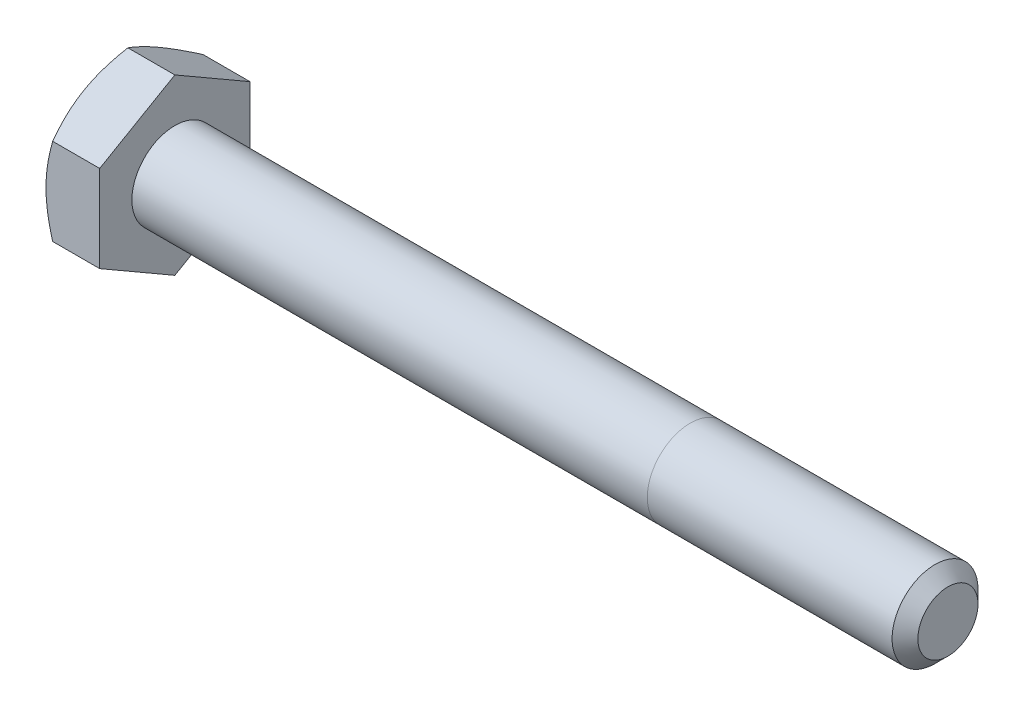
from build123d import *

# Parameters (mm, degrees)
SKETCH5_R           = 3.175
BOSS_EXTRUDE3_DEPTH = 57.15
CHAMFER1_SIZE       = 0.9525
BOSS_EXTRUDE4_DEPTH = 3.96875
SKETCH8_OUTSIDE_W   = 243.016
SKETCH8_OUTSIDE_H   = 244.736
SKETCH8_OUTSIDE_R   = 5.55625
CUT_EXTRUDE3_DEPTH  = 62.705235335
CUT_EXTRUDE3_DRAFT  = -60
CUT_EXTRUDE4_DEPTH  = 0.254
CIRPATTERN1_COUNT   = 3


with BuildPart() as part:
    # Sketch5 → Boss-Extrude3 (new body)
    with BuildSketch(Plane(origin=(30.559375, 0, 0), x_dir=(0, 0, -1), z_dir=(1, 0, 0))):
        Circle(SKETCH5_R)
    extrude(amount=-BOSS_EXTRUDE3_DEPTH)

    # Chamfer1
    chamfer1_edges = [part.edges().sort_by_distance(p)[0] for p in [
        (30.559375, 0, 3.175),
    ]]
    chamfer(chamfer1_edges, length=CHAMFER1_SIZE)

    # Sketch11 → Revolve1 (revolve)
    with BuildSketch(Plane.XY):
        Polygon((-26.590625, 3.175), (-26.590625, 0), (14.684375, 0), (11.509375, 3.175), align=None)
    revolve(axis=Axis((-26.590625, 0, 0), (1, 0, 0)))

    # Sketch6 → Boss-Extrude4 (add)
    with BuildSketch(Plane.ZY.offset(26.590625)):
        Polygon((5.55625, 3.207902433), (0, 6.415804866), (-5.55625, 3.207902433), (-5.55625, -3.207902433), (0, -6.415804866), (5.55625, -3.207902433), align=None)
    extrude(amount=BOSS_EXTRUDE4_DEPTH)


with BuildPart() as cut_extrude3_tool:
    # Sketch8 outside → Cut-Extrude3 (with draft: the straight prism first)
    with BuildSketch(Plane.ZY.offset(30.559375)):
        Rectangle(SKETCH8_OUTSIDE_W, SKETCH8_OUTSIDE_H)
        Circle(SKETCH8_OUTSIDE_R, mode=Mode.SUBTRACT)
    extrude(amount=-CUT_EXTRUDE3_DEPTH)
    # Cut-Extrude3: the draft: its side faces are tilted about the plane it starts from
    cut_extrude3_sides = [cut_extrude3_tool.faces().sort_by_distance(p)[0] for p in [
        (0.793242667, -122.368, 0),
        (0.793242667, 0, 121.508),
        (0.793242667, 122.368, 0),
        (0.793242667, 0, -121.508),
        (0.793242667, 0, -5.55625),
    ]]
    draft(cut_extrude3_sides, Plane.ZY.offset(30.559375), CUT_EXTRUDE3_DRAFT)


with BuildPart() as part_1:
    add(part.part)

    # Cut-Extrude3: cut by cut_extrude3_tool
    add(cut_extrude3_tool.part, mode=Mode.SUBTRACT)

    # Sketch12 → Cut-Extrude4 (cut)
    with BuildSketch(Plane.ZY.offset(30.559375)):
        with BuildLine():
            Line((0.1666875, 4.2783125), (0.1666875, 2.3891875))
            ThreePointArc((0.1666875, 2.3891875), (0, 2.2225), (-0.1666875, 2.3891875))
            Line((-0.1666875, 2.3891875), (-0.1666875, 4.2783125))
            ThreePointArc((-0.1666875, 4.2783125), (0, 4.445), (0.1666875, 4.2783125))
        make_face()
    cut_extrude4 = extrude(amount=-CUT_EXTRUDE4_DEPTH, mode=Mode.SUBTRACT)

    # CirPattern1: Cut-Extrude4 ×3 about axis
    cirpattern1_axis = Axis((0, 0, 0), (1, 0, 0))
    for i in range(1, CIRPATTERN1_COUNT):
        add(cut_extrude4.rotate(cirpattern1_axis, i * 360 / CIRPATTERN1_COUNT), mode=Mode.SUBTRACT)


solid = part_1.part
